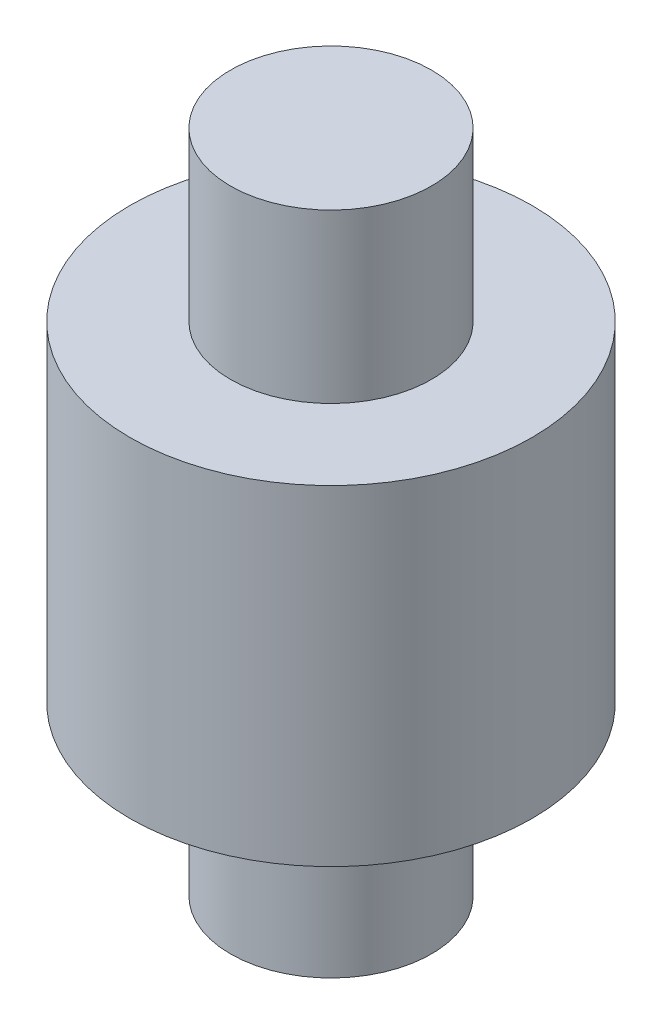
from build123d import *


with BuildPart() as part:
    # Sketch1 → Revolve1 (revolve)
    with BuildSketch(Plane(origin=(0, 0, 0), x_dir=(-1, 0, 0), z_dir=(0, 0, -1)), mode=Mode.PRIVATE) as revolve1_sk:
        Polygon((-1.524, 0), (0, 0), (0, 10.0838), (-1.524, 10.0838), (-1.524, 7.5438), (-3.048, 7.5438), (-3.048, 2.54), (-1.524, 2.54), align=None)
    revolve(revolve1_sk.sketch.rotate(Axis((0, 0, 0), (0, 1, 0)), 270), axis=Axis((0, 0, 0), (0, 1, 0)))


solid = part.part
